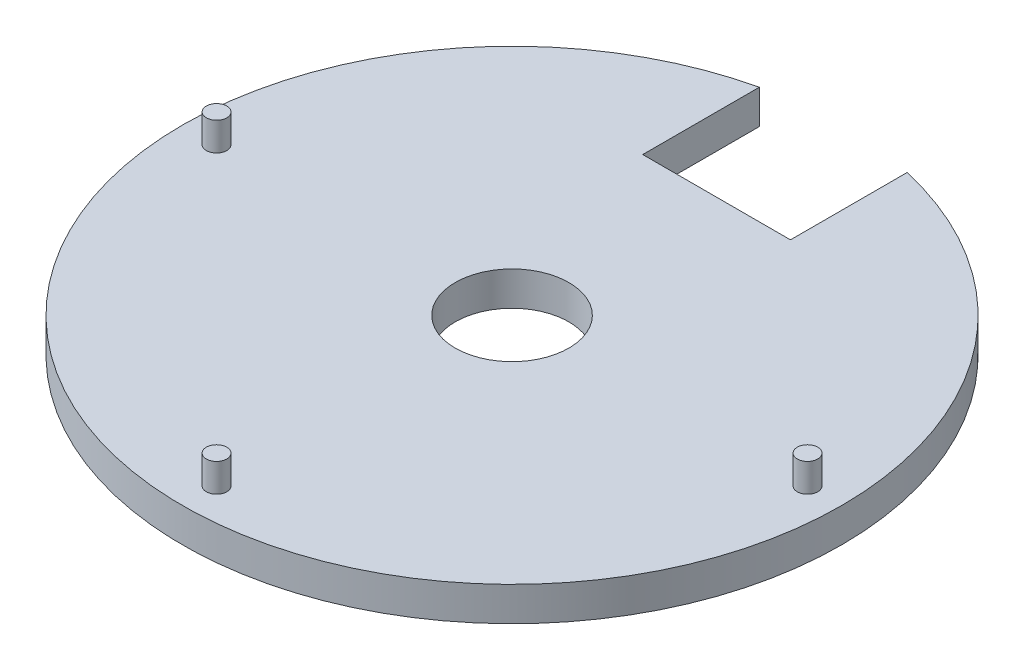
from build123d import *

# Parameters (mm, degrees)
SKETCH1_R           = 29
BOSS_EXTRUDE1_DEPTH = 3
CUT_EXTRUDE1_DEPTH  = 3
SKETCH6_R           = 0.9
BOSS_EXTRUDE3_DEPTH = 2.5
SKETCH7_R           = 0.9
BOSS_EXTRUDE4_DEPTH = 2.5
SKETCH8_R           = 5
CUT_EXTRUDE2_DEPTH  = 3


with BuildPart() as part:
    # Sketch1 → Boss-Extrude1 (new body)
    with BuildSketch(Plane(origin=(0, 0, 0), x_dir=(1, 0, 0), z_dir=(0, 1, 0))):
        with Locations(Location((0, 0, 0), (0, 0, 270))):
            Circle(SKETCH1_R)
    extrude(amount=BOSS_EXTRUDE1_DEPTH)

    # Sketch2 → Cut-Extrude1 (cut)
    with BuildSketch(Plane(origin=(0, 3, 0), x_dir=(1, 0, 0), z_dir=(0, 1, 0))):
        Polygon((0, 29), (6.5, 29), (6.5, 18), (-6.5, 18), (-6.5, 29), align=None)
    extrude(amount=-CUT_EXTRUDE1_DEPTH, mode=Mode.SUBTRACT)

    # Sketch6 → Boss-Extrude3 (add)
    with BuildSketch(Plane(origin=(0, 3, 0), x_dir=(1, 0, 0), z_dir=(0, 1, 0))):
        with Locations(Location((-26, 0, 0), (0, 0, 270))):
            Circle(SKETCH6_R)
        with Locations(Location((26, 0, 0), (0, 0, 270))):
            Circle(SKETCH6_R)
    extrude(amount=BOSS_EXTRUDE3_DEPTH)

    # Sketch7 → Boss-Extrude4 (add)
    with BuildSketch(Plane(origin=(0, 3, 0), x_dir=(1, 0, 0), z_dir=(0, 1, 0))):
        with Locations(Location((0, -26, 0), (0, 0, 270))):
            Circle(SKETCH7_R)
    extrude(amount=BOSS_EXTRUDE4_DEPTH)

    # Sketch8 → Cut-Extrude2 (cut)
    with BuildSketch(Plane(origin=(0, 3, 0), x_dir=(1, 0, 0), z_dir=(0, 1, 0))):
        with Locations(Location((0, 0, 0), (0, 0, 270))):
            Circle(SKETCH8_R)
    extrude(amount=-CUT_EXTRUDE2_DEPTH, mode=Mode.SUBTRACT)


solid = part.part
